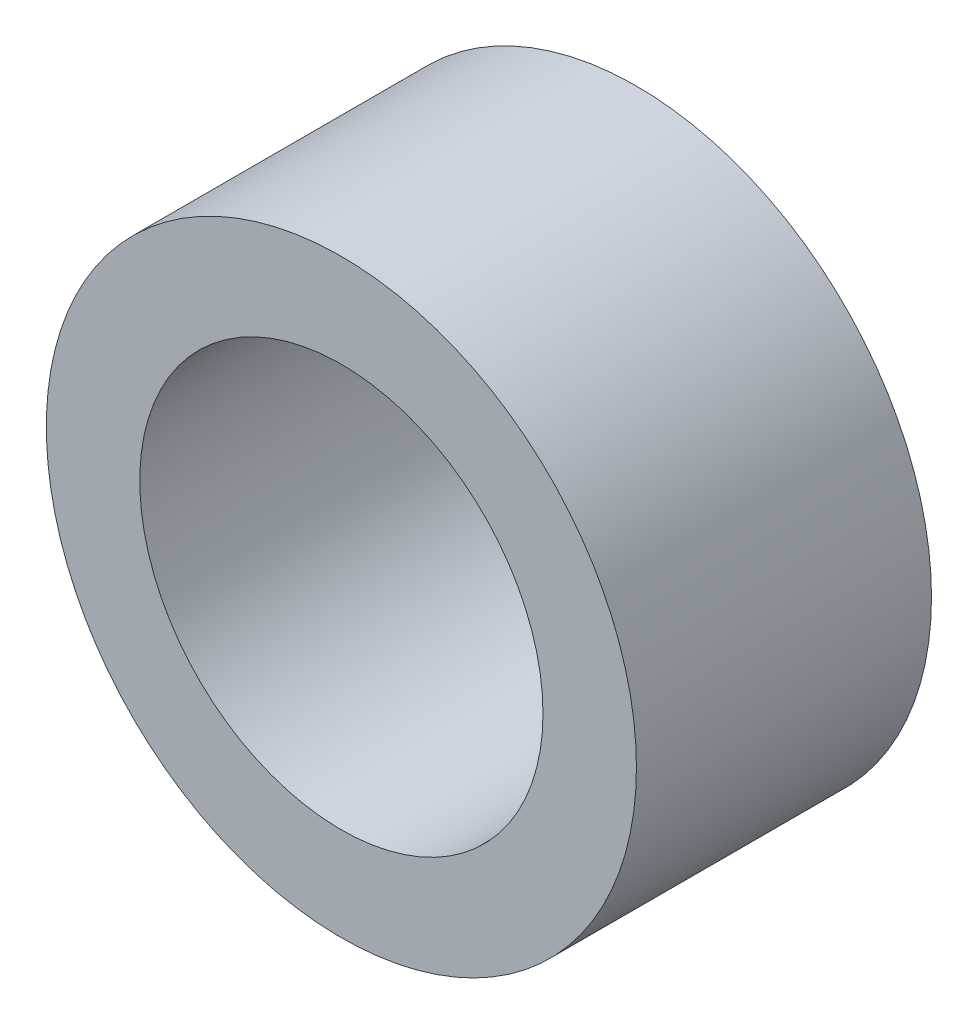
from build123d import *

# Parameters (mm, degrees)
SKETCH5_W          = 6
SKETCH5_H          = 6
SKETCH7_R          = 4.1
CUT_EXTRUDE1_DEPTH = 11.392304845


with BuildPart() as part:
    # Sketch5 → Revolve1 (revolve)
    with BuildSketch(Plane(origin=(0, 0, 0), x_dir=(0, 0, -1), z_dir=(0, 1, 0)), mode=Mode.PRIVATE) as revolve1_sk:
        with Locations((0, 3)):
            Rectangle(SKETCH5_W, SKETCH5_H)
    revolve(revolve1_sk.sketch.rotate(Axis((0, 0, 3), (0, 0, -1)), 180), axis=Axis((0, 0, 3), (0, 0, -1)))

    # Sketch7 → Cut-Extrude1 (cut, through all)
    with BuildSketch(Plane.XY.offset(3)):
        Circle(SKETCH7_R)
    extrude(amount=-CUT_EXTRUDE1_DEPTH, mode=Mode.SUBTRACT)


solid = part.part
